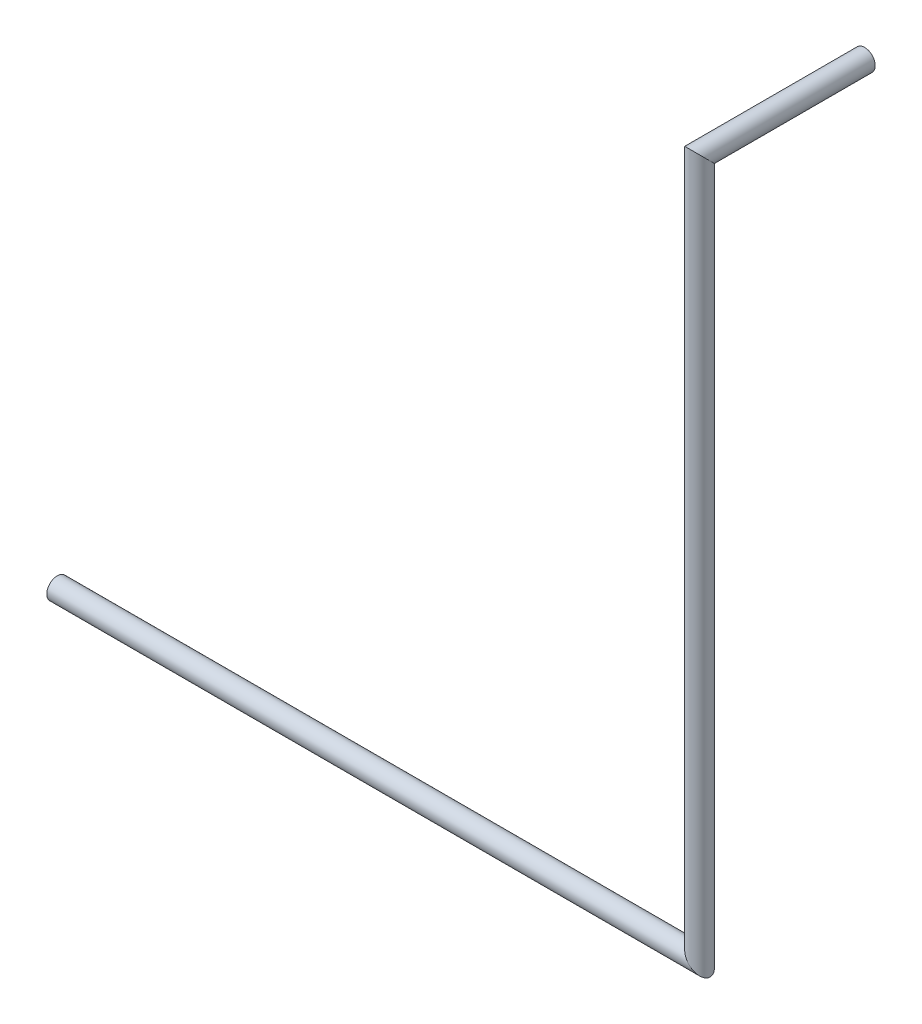
from build123d import *

# Parameters (mm, degrees)
ESQUISSE1_R = 2.5


with BuildPart() as part:
    # Balayage1: sweep along a curve in space
    with BuildLine() as balayage1_path:
        Line((0, 0, 0), (152.47, 0, 0))
        Line((152.47, 0, 0), (152.47, 165.26, 0))
        Line((152.47, 165.26, 0), (152.47, 165.26, -39.19))
    # Esquisse1 → Balayage1 (sweep)
    with BuildSketch(Plane(origin=(0, 0, 0), x_dir=(0, 0, -1), z_dir=(1, 0, 0))):
        Circle(ESQUISSE1_R)
    sweep(path=balayage1_path.line, transition=Transition.RIGHT)


solid = part.part
